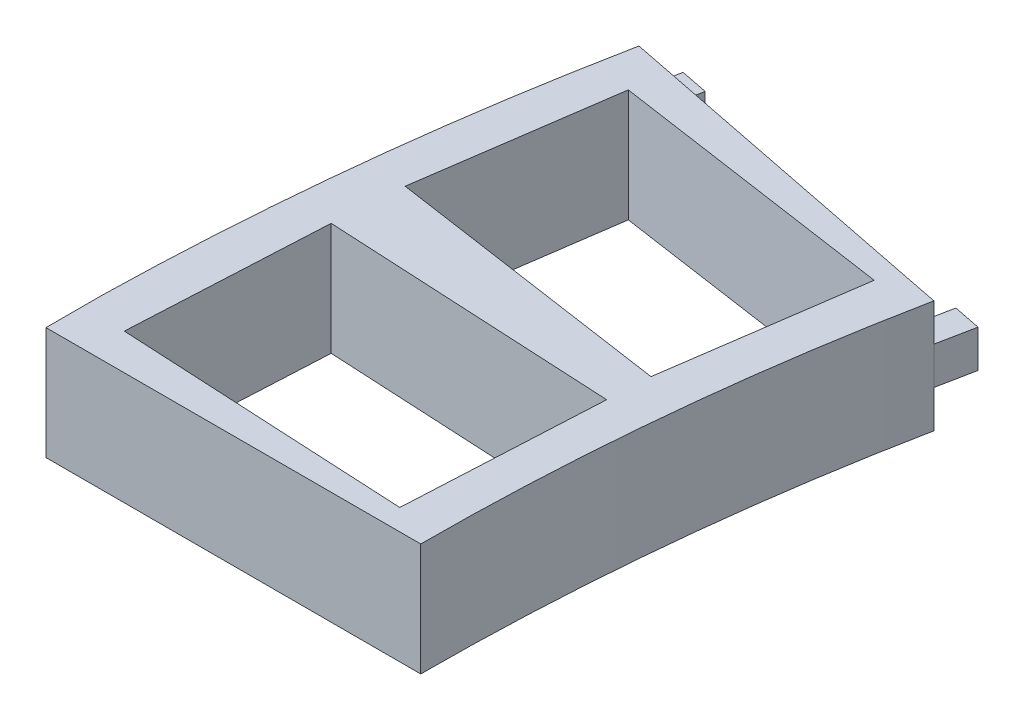
from build123d import *

# Parameters (mm, degrees)
BOSS_EXTRUDE1_DEPTH = 12
BOSS_EXTRUDE2_DEPTH = 3


with BuildPart() as part:
    # Sketch1 → Boss-Extrude1 (new body)
    with BuildSketch(Plane(origin=(0, 0, 0), x_dir=(1, 0, 0), z_dir=(0, 1, 0))):
        with BuildLine():
            Line((-289.517864278, 57.588683782), (-250.286431131, 49.785066539))
            ThreePointArc((-250.286431131, 49.785066539), (-253.961023409, 25.012977594), (-255.189832201, 0))
            Line((-255.189832201, 0), (-295.127762341, 0))
            Line((-295.127762341, 0), (-295.127762341, 6.054265565))
            ThreePointArc((-295.127762341, 6.054265565), (-293.456259512, 31.944858577), (-289.517864278, 57.588683782))
        make_face()
        Polygon((-255.364905165, 48.501157726), (-258.362561508, 27.716209892), (-289.038525769, 32.186692712), (-286.040869426, 52.971640546), align=None, mode=Mode.SUBTRACT)
        Polygon((-258.596218965, 23.222280187), (-259.674858729, 2.25), (-290.633540871, 3.85), (-289.554901108, 24.822280187), align=None, mode=Mode.SUBTRACT)
    extrude(amount=BOSS_EXTRUDE1_DEPTH)

    # Sketch4 → Boss-Extrude2 (add)
    with BuildSketch(Plane(origin=(-250.286431131, 0, -49.785066539), x_dir=(0.19509032201612864, 0, -0.9807852804032304), z_dir=(0.9807852804032303, 0, 0.1950903220161286))):
        Polygon((-0.699680901, 12), (0, 12), (0, 8), (4, 8), (4, 4), (0, 4), (0, 0), (-0.699680901, 0), align=None)
    boss_extrude2 = extrude(amount=-BOSS_EXTRUDE2_DEPTH)

    # Mirror3: Boss-Extrude2 across plane
    add(boss_extrude2.mirror(Plane(origin=(-269.902136739, 0, -53.68687298), x_dir=(-0.19509032201612864, 0, 0.9807852804032303), z_dir=(0.9807852804032304, 0, 0.19509032201612864))))


solid = part.part
